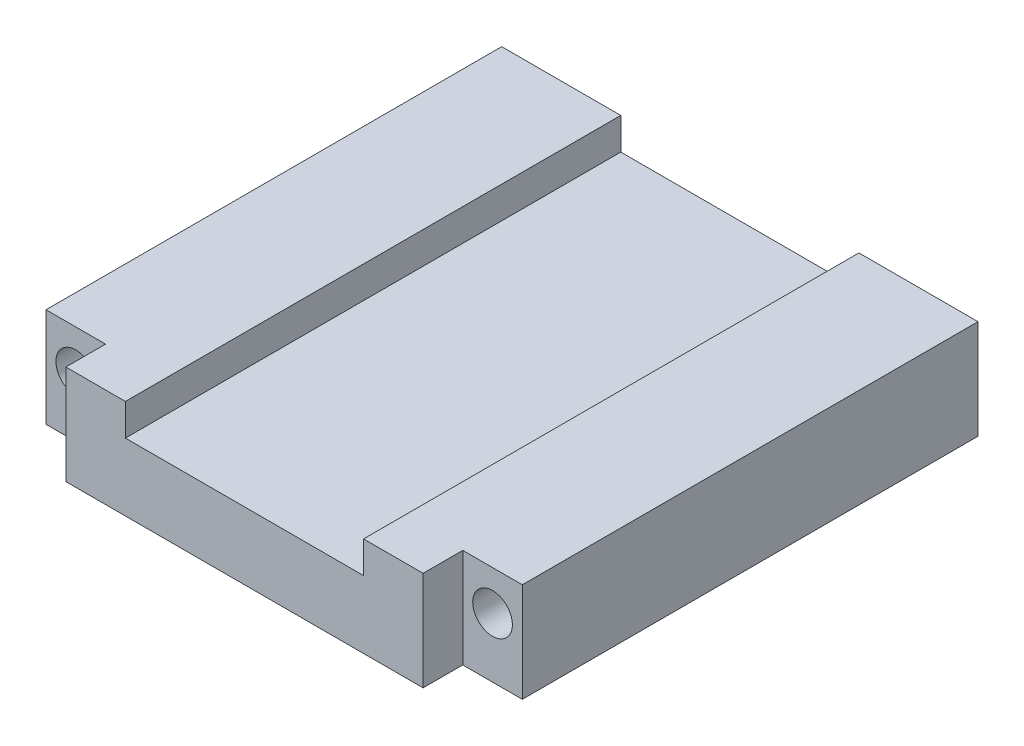
from build123d import *

# Parameters (mm, degrees)
SKETCH1_W                           = 38.1
SKETCH1_H                           = 7.9375
BOSS_EXTRUDE1_DEPTH                 = 39.624
SKETCH2_W                           = 19.05
SKETCH2_H                           = 2.54
CUT_EXTRUDE1_DEPTH                  = 45.144250504
F_1_8_0_125_CLEARANCE_DOWEL_HOLE1_D = 3.175
SKETCH6_W                           = 4.7625
SKETCH6_H                           = 7.9375
CUT_EXTRUDE2_DEPTH                  = 3.175


with BuildPart() as part:
    # Sketch1 → Boss-Extrude1 (new body)
    with BuildSketch(Plane.XY):
        Rectangle(SKETCH1_W, SKETCH1_H)
    extrude(amount=BOSS_EXTRUDE1_DEPTH)

    # Sketch2 → Cut-Extrude1 (cut, through all)
    with BuildSketch(Plane.XY.offset(39.624)):
        with Locations((0, 2.69875)):
            Rectangle(SKETCH2_W, SKETCH2_H)
    extrude(amount=-CUT_EXTRUDE1_DEPTH, mode=Mode.SUBTRACT)

    # 1/8 (0.125) Clearance Dowel Hole1 (through all)
    with Locations(Plane(origin=(0, 0, 0), x_dir=(-1, 0, 0), z_dir=(0, 0, -1))):
        with Locations((-16.66875, 0.79375), (16.66875, 0.79375)):
            Hole(F_1_8_0_125_CLEARANCE_DOWEL_HOLE1_D / 2)

    # Sketch6 → Cut-Extrude2 (cut)
    with BuildSketch(Plane.XY.offset(39.624)):
        with Locations((-16.66875, 0)):
            Rectangle(SKETCH6_W, SKETCH6_H)
        with Locations((16.66875, 0)):
            Rectangle(SKETCH6_W, SKETCH6_H)
    extrude(amount=-CUT_EXTRUDE2_DEPTH, mode=Mode.SUBTRACT)


solid = part.part
